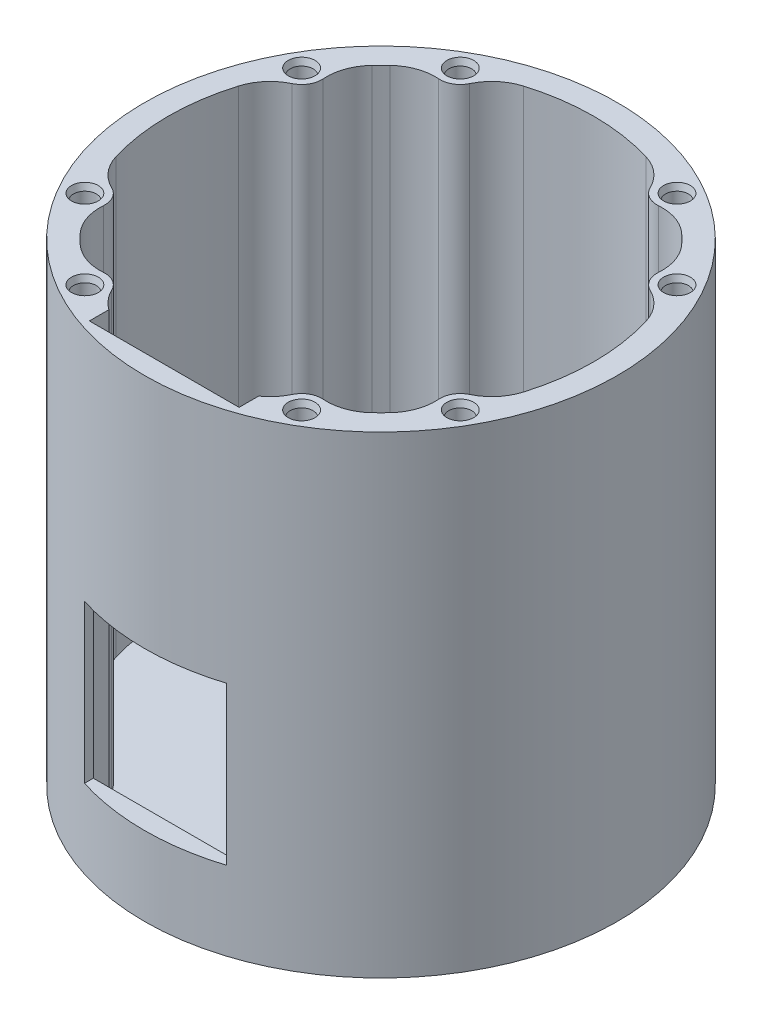
from build123d import *

# Parameters (mm, degrees)
SKETCH1_R               = 30
BOSS_EXTRUDE1_DEPTH     = 60
CUT_EXTRUDE1_DEPTH      = 55
FILLET1_R               = 6
SKETCH4_W               = 19
SKETCH4_H               = 3
CUT_EXTRUDE3_DEPTH      = 55
CUT_EXTRUDE5_REACH      = 75.485
CUT_EXTRUDE5_END_RADIUS = 30
SKETCH7_W               = 18
SKETCH7_H               = 20
HOLEWZD1_AT_2_COUNT     = 2
HOLEWZD1_AT_2_PITCH     = 14.235047481
HOLEWZD1_AT_3_COUNT     = 2
HOLEWZD1_AT_3_PITCH     = 38.890872965
HOLEWZD1_AT_4_COUNT     = 2
HOLEWZD1_AT_4_PITCH     = 47.631397208
HOLEWZD1_AT_5_COUNT     = 2
HOLEWZD1_AT_5_PITCH     = 55
HOLEWZD1_AT_6_COUNT     = 2
HOLEWZD1_AT_6_PITCH     = 53.125920446
HOLEWZD1_AT_7_COUNT     = 2
HOLEWZD1_AT_7_PITCH     = 38.890872965
HOLEWZD1_AT_8_COUNT     = 2
HOLEWZD1_AT_8_PITCH     = 27.5


with BuildPart() as part:
    # Sketch1 → Boss-Extrude1 (new body)
    with BuildSketch(Plane(origin=(0, 0, 0), x_dir=(1, 0, 0), z_dir=(0, 1, 0))):
        with Locations(Location((0, 0, 0), (0, 0, 270))):
            Circle(SKETCH1_R)
    extrude(amount=BOSS_EXTRUDE1_DEPTH)

    # Sketch2 → Cut-Extrude1 (cut)
    with BuildSketch(Plane(origin=(0, 60, 0), x_dir=(1, 0, 0), z_dir=(0, 1, 0))):
        with BuildLine():
            ThreePointArc((-15.586619137, 22.046707325), (-19.091883092, 19.091883092), (-22.046707325, 15.586619137))
            ThreePointArc((-22.046707325, 15.586619137), (-21.607333824, 12.475), (-24.521761794, 11.299699045))
            ThreePointArc((-24.521761794, 11.299699045), (-27, 0), (-24.521761794, -11.299699045))
            ThreePointArc((-24.521761794, -11.299699045), (-21.607333824, -12.475), (-22.046707325, -15.586619137))
            ThreePointArc((-22.046707325, -15.586619137), (-19.091883092, -19.091883092), (-15.586619137, -22.046707325))
            ThreePointArc((-15.586619137, -22.046707325), (-12.475, -21.607333824), (-11.299699045, -24.521761794))
            ThreePointArc((-11.299699045, -24.521761794), (0, -27), (11.299699045, -24.521761794))
            ThreePointArc((11.299699045, -24.521761794), (12.475, -21.607333824), (15.586619137, -22.046707325))
            ThreePointArc((15.586619137, -22.046707325), (19.091883092, -19.091883092), (22.046707325, -15.586619137))
            ThreePointArc((22.046707325, -15.586619137), (21.607333824, -12.475), (24.521761794, -11.299699045))
            ThreePointArc((24.521761794, -11.299699045), (27, 0), (24.521761794, 11.299699045))
            ThreePointArc((24.521761794, 11.299699045), (21.607333824, 12.475), (22.046707325, 15.586619137))
            ThreePointArc((22.046707325, 15.586619137), (19.091883092, 19.091883092), (15.586619137, 22.046707325))
            ThreePointArc((15.586619137, 22.046707325), (12.475, 21.607333824), (11.299699045, 24.521761794))
            ThreePointArc((11.299699045, 24.521761794), (0, 27), (-11.299699045, 24.521761794))
            ThreePointArc((-11.299699045, 24.521761794), (-12.475, 21.607333824), (-15.586619137, 22.046707325))
        make_face()
    extrude(amount=-CUT_EXTRUDE1_DEPTH, mode=Mode.SUBTRACT)

    # Fillet1
    fillet1_edges = [part.edges().sort_by_distance(p)[0] for p in [
        (-24.521761794, 32.5, 11.299699045),
        (-24.521761794, 32.5, -11.299699045),
        (-22.046707325, 32.5, -15.586619137),
        (-15.586619137, 32.5, -22.046707325),
        (-11.299699045, 32.5, -24.521761794),
        (11.299699045, 32.5, -24.521761794),
        (15.586619137, 32.5, -22.046707325),
        (22.046707325, 32.5, -15.586619137),
        (24.521761794, 32.5, -11.299699045),
        (24.521761794, 32.5, 11.299699045),
        (22.046707325, 32.5, 15.586619137),
        (15.586619137, 32.5, 22.046707325),
        (11.299699045, 32.5, 24.521761794),
        (-11.299699045, 32.5, 24.521761794),
        (-15.586619137, 32.5, 22.046707325),
        (-22.046707325, 32.5, 15.586619137),
    ]]
    fillet(fillet1_edges, radius=FILLET1_R)

    # Sketch4 → Cut-Extrude3 (cut)
    with BuildSketch(Plane(origin=(0, 60, 0), x_dir=(1, 0, 0), z_dir=(0, 1, 0))):
        with Locations((0, -26)):
            Rectangle(SKETCH4_W, SKETCH4_H)
    extrude(amount=-CUT_EXTRUDE3_DEPTH, mode=Mode.SUBTRACT)

    # Cut-Extrude5: up to this cylinder (the profile starts inside it)
    cut_extrude5_end = Plane(origin=(0, 20, 0), z_dir=(0, -1, 0)) * Cylinder(CUT_EXTRUDE5_END_RADIUS, 211.97, mode=Mode.PRIVATE)
    # Sketch7 → Cut-Extrude5 (cut, up to the surface)
    with BuildSketch(Plane.XY, mode=Mode.PRIVATE) as cut_extrude5_sk1:
        with Locations((0, 20)):
            Rectangle(SKETCH7_W, SKETCH7_H)
    cut_extrude5_tool1 = extrude(cut_extrude5_sk1.sketch, amount=CUT_EXTRUDE5_REACH, mode=Mode.PRIVATE) & cut_extrude5_end
    add(cut_extrude5_tool1.solids().sort_by_distance((0, 20, 0))[0], mode=Mode.SUBTRACT)

    # Sketch8 → HoleWzd1 (revolve, cut)
    with BuildSketch(Plane(origin=(-13.75, 60, -23.815698604), x_dir=(0, 0, 1), z_dir=(1, 0, 0))):
        Polygon((0, 0), (0, 5), (1.45, 5), (1.45, 0.800197428), (1.7, 0), align=None)
    holewzd1 = revolve(axis=Axis((-13.75, 66.445314094, -23.815698604), (0, -1, 0)), mode=Mode.SUBTRACT)

    # HoleWzd1 at 2: HoleWzd1 ×2
    with Locations(*[Vector(-0.7071067811864459, 0, 0.7071067811866492) * (i * HOLEWZD1_AT_2_PITCH) for i in range(1, HOLEWZD1_AT_2_COUNT)]):
        add(holewzd1, mode=Mode.SUBTRACT)

    # HoleWzd1 at 3: HoleWzd1 ×2
    with Locations(*[Vector(-0.2588190451024979, 0, 0.9659258262890744) * (i * HOLEWZD1_AT_3_PITCH) for i in range(1, HOLEWZD1_AT_3_COUNT)]):
        add(holewzd1, mode=Mode.SUBTRACT)

    # HoleWzd1 at 4: HoleWzd1 ×2
    with Locations(*[(0, 0, i * HOLEWZD1_AT_4_PITCH) for i in range(1, HOLEWZD1_AT_4_COUNT)]):
        add(holewzd1, mode=Mode.SUBTRACT)

    # HoleWzd1 at 5: HoleWzd1 ×2
    with Locations(*[Vector(0.5000000000000439, 0, 0.8660254037844134) * (i * HOLEWZD1_AT_5_PITCH) for i in range(1, HOLEWZD1_AT_5_COUNT)]):
        add(holewzd1, mode=Mode.SUBTRACT)

    # HoleWzd1 at 6: HoleWzd1 ×2
    with Locations(*[Vector(0.7071067811865593, 0, 0.7071067811865357) * (i * HOLEWZD1_AT_6_PITCH) for i in range(1, HOLEWZD1_AT_6_COUNT)]):
        add(holewzd1, mode=Mode.SUBTRACT)

    # HoleWzd1 at 7: HoleWzd1 ×2
    with Locations(*[Vector(0.9659258262890814, 0, 0.258819045102472) * (i * HOLEWZD1_AT_7_PITCH) for i in range(1, HOLEWZD1_AT_7_COUNT)]):
        add(holewzd1, mode=Mode.SUBTRACT)

    # HoleWzd1 at 8: HoleWzd1 ×2
    with Locations(*[(i * HOLEWZD1_AT_8_PITCH, 0, 0) for i in range(1, HOLEWZD1_AT_8_COUNT)]):
        add(holewzd1, mode=Mode.SUBTRACT)


solid = part.part
